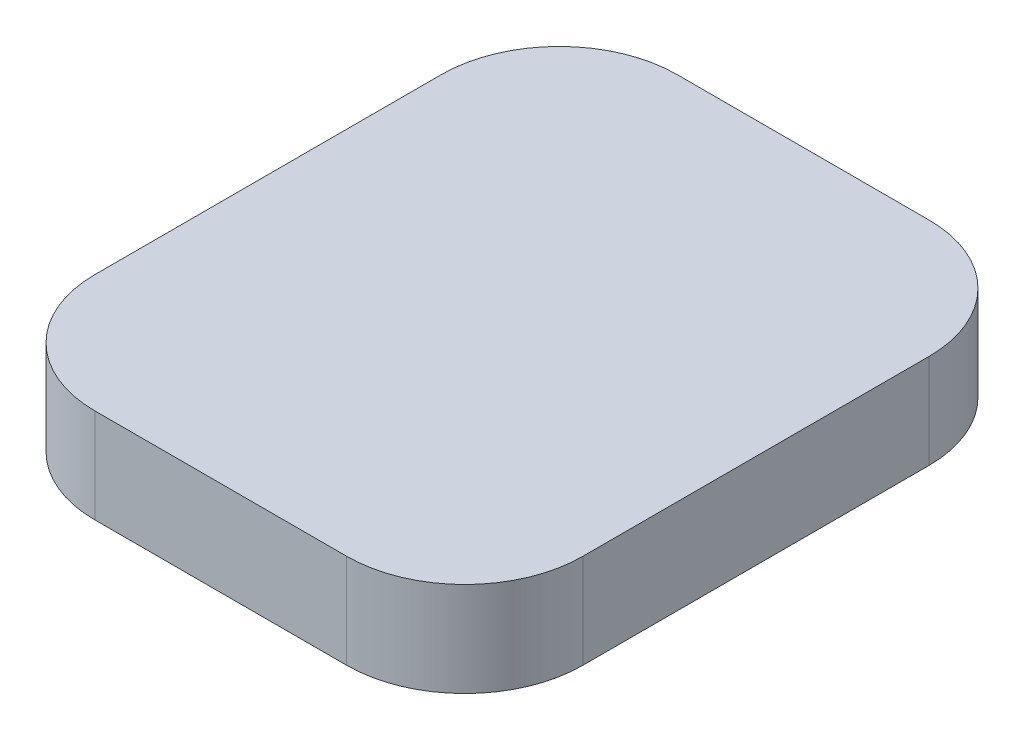
from build123d import *

# Parameters (mm, degrees)
BOSS_EXTRUDE1_DEPTH = 3


with BuildPart() as part:
    # Sketch1 → Boss-Extrude1 (new body)
    with BuildSketch(Plane(origin=(0, 0, 0), x_dir=(1, 0, 0), z_dir=(0, 1, 0))):
        with BuildLine():
            Line((-4.5, 9.25), (3.5, 9.25))
            ThreePointArc((3.5, 9.25), (6.151650429, 8.151650429), (7.25, 5.5))
            Line((7.25, 5.5), (7.25, -5.5))
            ThreePointArc((7.25, -5.5), (6.151650429, -8.151650429), (3.5, -9.25))
            Line((3.5, -9.25), (-4.5, -9.25))
            ThreePointArc((-4.5, -9.25), (-7.151650429, -8.151650429), (-8.25, -5.5))
            Line((-8.25, -5.5), (-8.25, 5.5))
            ThreePointArc((-8.25, 5.5), (-7.151650429, 8.151650429), (-4.5, 9.25))
        make_face()
    extrude(amount=BOSS_EXTRUDE1_DEPTH)


solid = part.part
